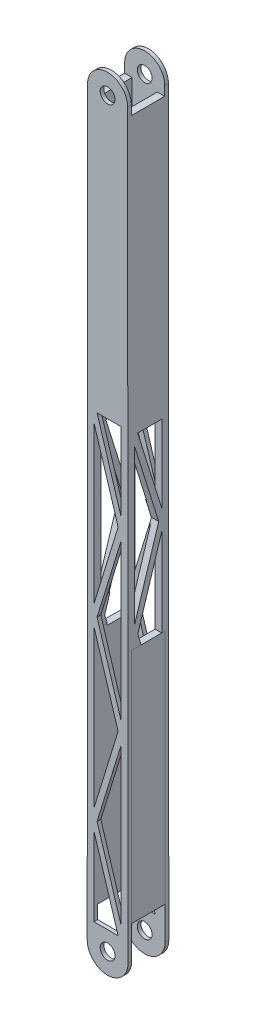
from build123d import *

# Parameters (mm, degrees)
SKETCH1_R               = 10
BOSS_EXTRUDE2_DEPTH     = 5
BOSS_EXTRUDE3_DEPTH     = 55
BOSS_EXTRUDE4_START     = 50
SKETCH1_4_R             = 10
BOSS_EXTRUDE4_DEPTH     = 5
CUT_EXTRUDE2_DEPTH      = 1030.927549364
CUT_EXTRUDE2_DEPTH_BACK = 1030.927549364
CUT_EXTRUDE4_DEPTH      = 1029.839273162
CUT_EXTRUDE4_DEPTH_BACK = 1029.839273162
SKETCH5_W               = 8.968511721
SKETCH5_H               = 45
BOSS_EXTRUDE5_DEPTH     = 319


with BuildPart() as part:
    # Sketch1 → Boss-Extrude2 (new body)
    with BuildSketch(Plane.XY):
        with BuildLine():
            Line((27.006290467, 987.419065417), (27, 1000))
            ThreePointArc((27, 1000), (11.625043938, 1024.369209126), (-16.989507662, 1020.984676061))
            ThreePointArc((-16.989507662, 1020.984676061), (-24.369209126, 1011.625043938), (-27, 1000))
            Line((-27, 1000), (-27.006290467, 987.419065417))
            Line((-27.006290467, 987.419065417), (-17.006290467, 987.419065417))
            Line((-17.006290467, 987.419065417), (-17.318511721, 362.976557611))
            Line((-17.318511721, 362.976557611), (-27.318511721, 362.976557611))
            Line((-27.318511721, 362.976557611), (-27.5, 0))
            ThreePointArc((-27.5, 0), (0, -27.5), (27.5, 0))
            Line((27.5, 0), (27.318511721, 362.976557611))
            Line((27.318511721, 362.976557611), (17.318511721, 362.976557611))
            Line((17.318511721, 362.976557611), (17.006290467, 987.419065417))
            Line((17.006290467, 987.419065417), (27.006290467, 987.419065417))
        make_face()
        Circle(SKETCH1_R, mode=Mode.SUBTRACT)
        with Locations((0, 1000)):
            Circle(SKETCH1_R, mode=Mode.SUBTRACT)
    extrude(amount=BOSS_EXTRUDE2_DEPTH)

    # Sketch1<3> → Boss-Extrude3 (add)
    with BuildSketch(Plane.XY):
        Polygon((27.318511721, 362.976557611), (27.006290467, 987.419065417), (17.006290467, 987.419065417), (17.318511721, 362.976557611), align=None)
        Polygon((-17.006290467, 987.419065417), (-27.006290467, 987.419065417), (-27.318511721, 362.976557611), (-17.318511721, 362.976557611), align=None)
    extrude(amount=BOSS_EXTRUDE3_DEPTH)

    # Sketch1<4> → Boss-Extrude4 (add)
    with BuildSketch(Plane.XY.offset(BOSS_EXTRUDE4_START)):
        with BuildLine():
            Line((27, 1000), (27.5, 0))
            ThreePointArc((27.5, 0), (0, -27.5), (-27.5, 0))
            Line((-27.5, 0), (-27, 1000))
            ThreePointArc((-27, 1000), (0, 1027), (27, 1000))
        make_face()
        Circle(SKETCH1_4_R, mode=Mode.SUBTRACT)
        with Locations((0, 1000)):
            Circle(SKETCH1_4_R, mode=Mode.SUBTRACT)
    extrude(amount=BOSS_EXTRUDE4_DEPTH)

    # Sketch3 → Cut-Extrude2 (cut, two sides: drawn at the far end of the back side and taken through both)
    with BuildSketch(Plane(origin=(27.499993125, 0.013749997, 0), x_dir=(0, 0, -1), z_dir=(0.9999998750000234, 0.0004999999375000122, 0)).offset(-CUT_EXTRUDE2_DEPTH_BACK)):
        Polygon((-9.15125207, 508.572247167), (-9.15125207, 612.557963539), (-41.657857257, 612.557963539), align=None)
        Polygon((-9.15125207, 273.788247167), (-9.15125207, 481.759679911), (-41.657857257, 377.773963539), align=None)
        Polygon((-13.342142743, 495.165963539), (-45.84874793, 599.151679911), (-45.84874793, 391.180247167), align=None)
    extrude(amount=CUT_EXTRUDE2_DEPTH + CUT_EXTRUDE2_DEPTH_BACK, mode=Mode.SUBTRACT)

    # Sketch4 → Cut-Extrude4 (cut, two sides: drawn at the far end of the back side and taken through both)
    with BuildSketch(Plane.XY.offset(55).offset(-CUT_EXTRUDE4_DEPTH_BACK)):
        Polygon((14.164977662, 264.312281668), (-18.35, 369.999248569), (-18.35, 158.625314767), align=None)
        Polygon((18.35, 277.915314767), (18.35, 383.602281668), (-14.164977662, 383.602281668), align=None)
        Polygon((18.35, 39.335314767), (18.35, 250.709248569), (-14.164977662, 145.022281668), align=None)
        Polygon((14.164977662, 502.892281668), (-18.35, 608.579248569), (-18.35, 397.205314767), align=None)
        Polygon((18.35, 383.602281668), (18.35, 489.289248569), (-14.164977662, 383.602281668), align=None)
        Polygon((18.35, 516.495314767), (18.35, 622.182281668), (-14.164977662, 622.182281668), align=None)
        Polygon((14.164712586, 25.733143274), (-18.35, 131.419248569), (-18.35, 25.733143274), align=None)
    extrude(amount=CUT_EXTRUDE4_DEPTH + CUT_EXTRUDE4_DEPTH_BACK, mode=Mode.SUBTRACT)

    # Sketch5 → Boss-Extrude5 (add)
    with BuildSketch(Plane.XZ.offset(-362.976557611)):
        with Locations((-22.834255861, 27.5)):
            Rectangle(SKETCH5_W, SKETCH5_H)
        with Locations((22.834255861, 27.5)):
            Rectangle(SKETCH5_W, SKETCH5_H)
    extrude(amount=BOSS_EXTRUDE5_DEPTH)


solid = part.part
